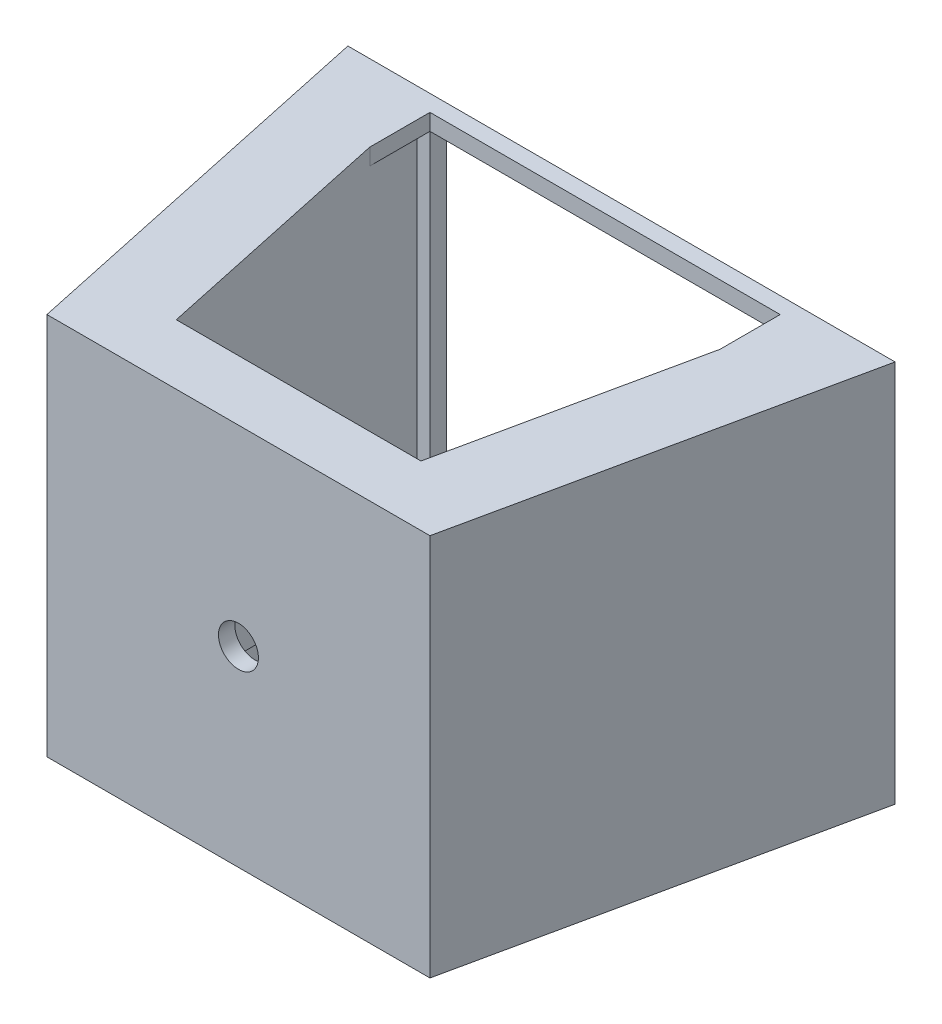
from build123d import *

# Parameters (mm, degrees)
SCHIZZO1_W                   = 70
SCHIZZO1_H                   = 70
ESTRUSIONE_ESTRUSIONE1_DEPTH = 70
SCHIZZO3_W                   = 64
SCHIZZO3_H                   = 64
TAGLIO_ESTRUSIONE2_DEPTH     = 67
TAGLIO_ESTRUSIONE1_REACH     = 87.732
SCHIZZO2_R                   = 3.65
TAGLIO_ESTRUSIONE3_START     = -70
SCHIZZO4_W                   = 64
SCHIZZO4_H                   = 64
TAGLIO_ESTRUSIONE3_DEPTH     = 70
SPECCHIA2_START              = -70
SPECCHIA2_COPY_1_SKETCH_W    = 64
SPECCHIA2_COPY_1_SKETCH_H    = 64
SPECCHIA2_COPY_1_DEPTH       = 70
ESTRUSIONE_ESTRUSIONE2_DEPTH = 15.3
SCHIZZO6_R                   = 1.5
TAGLIO_ESTRUSIONE4_DEPTH     = 3
SCHIZZO7_W                   = 42
SCHIZZO7_H                   = 14
SCHIZZO7_H_2                 = 11.35
ESTRUSIONE_ESTRUSIONE3_DEPTH = 8
SCHIZZO8_W                   = 15
SCHIZZO8_H                   = 70


with BuildPart() as part:
    # Schizzo1 → Estrusione-Estrusione1 (new body)
    with BuildSketch(Plane.XY):
        Rectangle(SCHIZZO1_W, SCHIZZO1_H)
    extrude(amount=ESTRUSIONE_ESTRUSIONE1_DEPTH)

    # Schizzo3 → Taglio-Estrusione2 (cut)
    with BuildSketch(Plane(origin=(0, 0, 0), x_dir=(-1, 0, 0), z_dir=(0, 0, -1))):
        Rectangle(SCHIZZO3_W, SCHIZZO3_H)
    extrude(amount=-TAGLIO_ESTRUSIONE2_DEPTH, mode=Mode.SUBTRACT)

    # Schizzo2 → Taglio-Estrusione1 (cut, up to next)
    with BuildSketch(Plane.XY.offset(70), mode=Mode.PRIVATE) as taglio_estrusione1_sk1:
        Circle(SCHIZZO2_R)
    taglio_estrusione1_tool1 = extrude(taglio_estrusione1_sk1.sketch, amount=-TAGLIO_ESTRUSIONE1_REACH, mode=Mode.PRIVATE) & part.part
    add(taglio_estrusione1_tool1.solids().sort_by_distance((0, 0, 70))[0], mode=Mode.SUBTRACT)

    # Schizzo4 → Taglio-Estrusione3 (cut)
    with BuildSketch(Plane.XZ.offset(35).offset(TAGLIO_ESTRUSIONE3_START)):
        with Locations((0, 35)):
            Rectangle(SCHIZZO4_W, SCHIZZO4_H)
    taglio_estrusione3 = extrude(amount=TAGLIO_ESTRUSIONE3_DEPTH, mode=Mode.SUBTRACT)

    # Specchia1: Taglio-Estrusione3 across plane
    add(taglio_estrusione3.mirror(Plane(origin=(0, 0, 0), x_dir=(0, 0, 1), z_dir=(-0.7071067811865476, 0.7071067811865475, 0))), mode=Mode.SUBTRACT)

    # Specchia2: Taglio-Estrusione3 across plane
    add(taglio_estrusione3.mirror(Plane(origin=(0, 0, 0), x_dir=(0, 0, 1), z_dir=(-0.7071067811865476, 0.7071067811865475, 0))), mode=Mode.SUBTRACT)

    # Specchia2 copy 1 sketch → Specchia2 copy 1 (cut)
    with BuildSketch(Plane.XZ.offset(35).offset(SPECCHIA2_START)):
        with Locations((0, 35)):
            Rectangle(SPECCHIA2_COPY_1_SKETCH_W, SPECCHIA2_COPY_1_SKETCH_H)
    extrude(amount=SPECCHIA2_COPY_1_DEPTH, mode=Mode.SUBTRACT)

    # Schizzo5 → Estrusione-Estrusione2 (add)
    with BuildSketch(Plane(origin=(0, 0, 67), x_dir=(-1, 0, 0), z_dir=(0, 0, -1))):
        Polygon((-21, 23.65), (21, 23.65), (21, -9.35), (8, -9.35), (8, 4.65), (-8, 4.65), (-8, -9.35), (-21, -9.35), align=None)
    extrude(amount=ESTRUSIONE_ESTRUSIONE2_DEPTH)

    # Schizzo6 → Taglio-Estrusione4 (cut)
    with BuildSketch(Plane(origin=(0, 0, 51.7), x_dir=(-1, 0, 0), z_dir=(0, 0, -1))):
        with Locations((-17.5, 7.5)):
            Circle(SCHIZZO6_R)
        with Locations(Location((17.5, 7.5, 0), (0, 0, 180))):
            Circle(SCHIZZO6_R)
    extrude(amount=-TAGLIO_ESTRUSIONE4_DEPTH, mode=Mode.SUBTRACT)

    # Schizzo7 → Estrusione-Estrusione3 (add)
    with BuildSketch(Plane(origin=(0, 0, 67), x_dir=(-1, 0, 0), z_dir=(0, 0, -1))):
        with Locations((0, -28)):
            Rectangle(SCHIZZO7_W, SCHIZZO7_H)
        Polygon((32, 32), (32, 35), (21, 35), (21, 23.65), (21, -9.35), (21, -21), (21, -35), (32, -35), (32, -32), (35, -32), (35, 32), align=None)
        with Locations((0, 29.325)):
            Rectangle(SCHIZZO7_W, SCHIZZO7_H_2)
        Polygon((-21, 23.65), (-21, 35), (-32, 35), (-32, 32), (-35, 32), (-35, -32), (-32, -32), (-32, -35), (-21, -35), (-21, -21), (-21, -9.35), align=None)
    extrude(amount=ESTRUSIONE_ESTRUSIONE3_DEPTH)

    # Sweep1: sweep along a path in Schizzo9
    with BuildLine(Plane.XZ.offset(35)) as sweep1_path:
        Line((35, 70), (50, 0))
    # Schizzo8 → Sweep1 (sweep)
    with BuildSketch(Plane(origin=(0, 0, 0), x_dir=(-1, 0, 0), z_dir=(0, 0, -1))):
        with Locations((-42.5, 0)):
            Rectangle(SCHIZZO8_W, SCHIZZO8_H)
    sweep1 = sweep(path=sweep1_path.line)

    # Specchia4: Sweep1 across plane
    add(sweep1.mirror(Plane(origin=(0, 0, 0), x_dir=(0, 0, 1), z_dir=(1, 0, 0))))


solid = part.part
